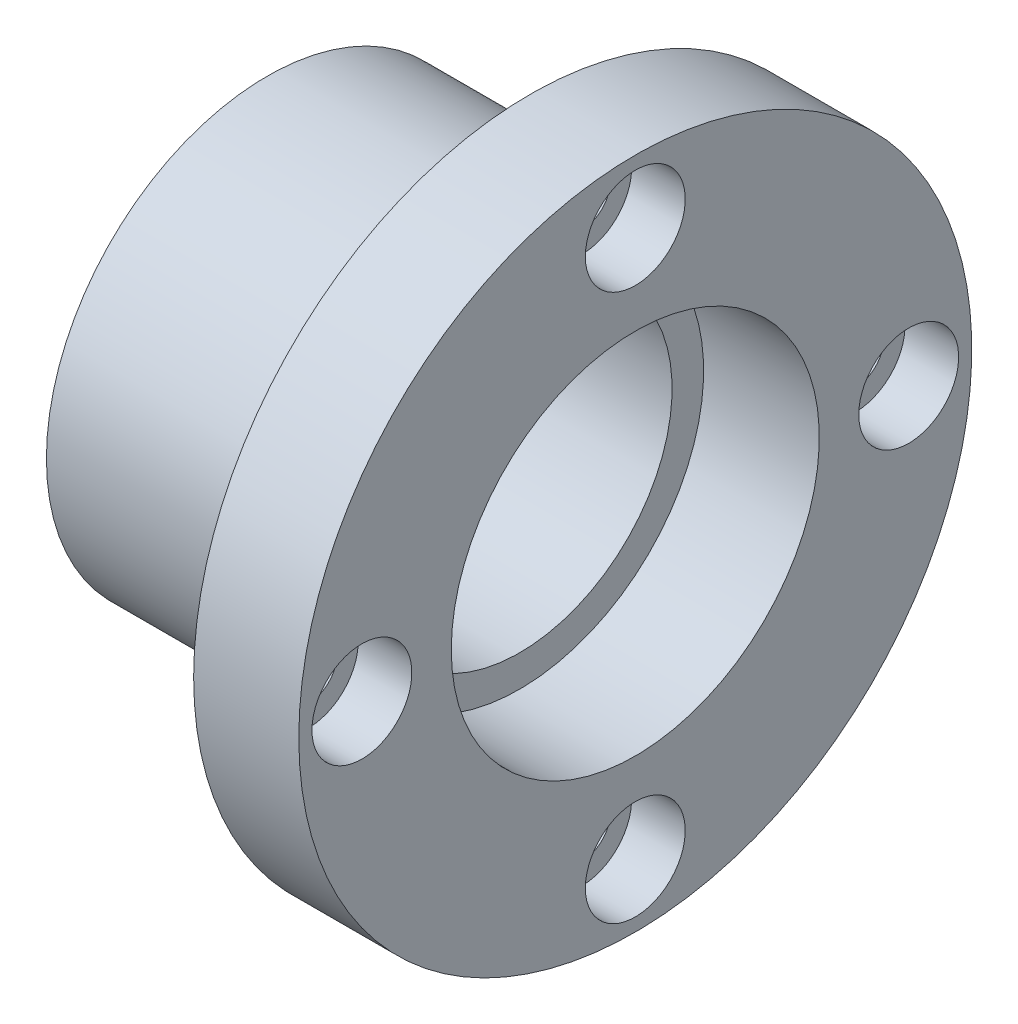
from build123d import *

# Parameters (mm, degrees)
PATTERN_LINEAR_1_COUNT      = 2
PATTERN_LINEAR_1_PITCH      = 36.769552622
PATTERN_LINEAR_1_COUNT_DIR2 = 2
PATTERN_LINEAR_1_PITCH_DIR2 = 36.769552622


with BuildPart() as part:
    # 草图1 → 旋转1 (revolve)
    with BuildSketch(Plane.XY):
        Polygon((-35, 21), (-35, 17.5), (-24, 17.5), (-24, 14.5), (-11, 14.5), (-11, 17.5), (0, 17.5), (0, 32), (-10, 32), (-10, 21), align=None)
    revolve(axis=Axis((0, 0, 0), (-1, 0, 0)))

    # 草图2 → 切除-旋转1 (revolve, cut)
    with BuildSketch(Plane.XY):
        Polygon((-10, 26), (-10, 28.75), (-5.1, 28.75), (-5.1, 30.75), (0, 30.75), (0, 26), align=None)
    cut_revolve_1 = revolve(axis=Axis((0, 26, 0), (-1, 0, 0)), mode=Mode.SUBTRACT)

    # 阵列(线性)1: Cut-Revolve 1 2 × 2
    with Locations(*[Vector(0, -0.7071067811865475, 0.7071067811865477) * (i * PATTERN_LINEAR_1_PITCH) + Vector(0, -0.7071067811865477, -0.7071067811865474) * (j * PATTERN_LINEAR_1_PITCH_DIR2) for i in range(PATTERN_LINEAR_1_COUNT) for j in range(PATTERN_LINEAR_1_COUNT_DIR2) if (i, j) != (0, 0)]):
        add(cut_revolve_1, mode=Mode.SUBTRACT)


solid = part.part
